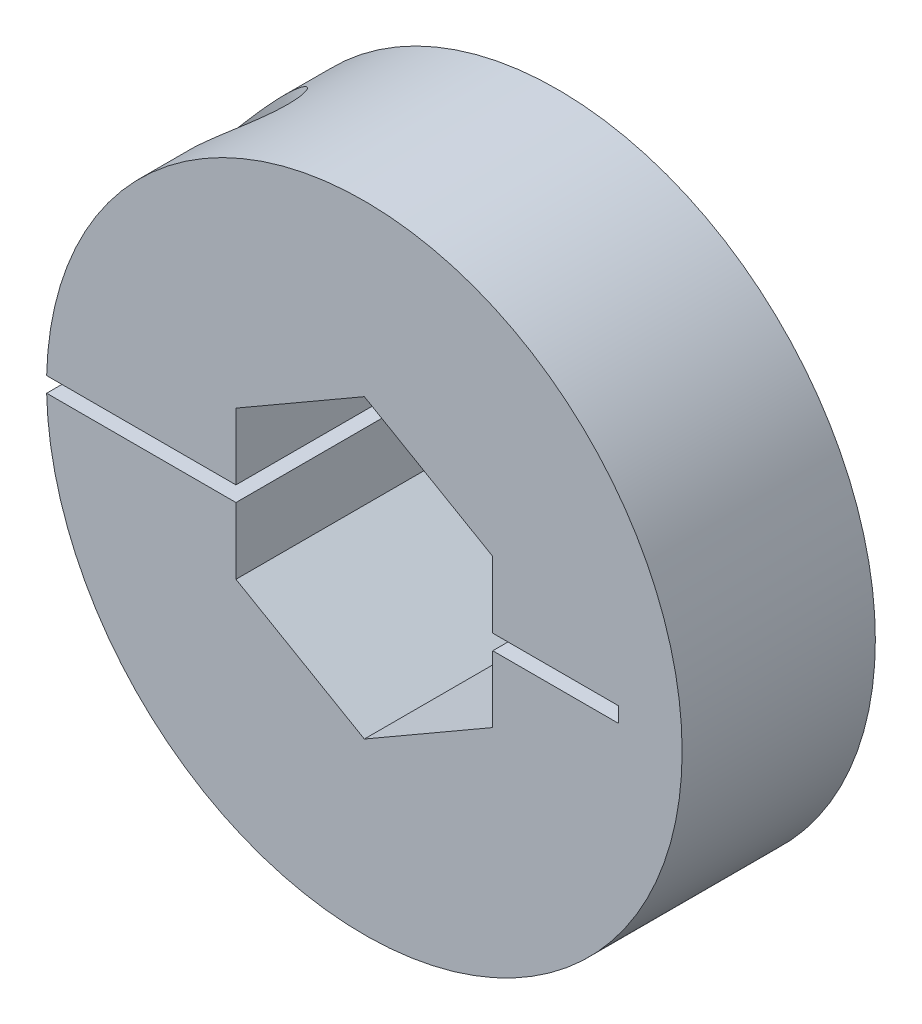
from build123d import *

# Parameters (mm, degrees)
SKETCH1_R               = 15.875
BOSS_EXTRUDE1_DEPTH     = 4.826
CUT_EXTRUDE1_DEPTH      = 25.437519391
CUT_EXTRUDE2_DEPTH      = 25.437519391
CUT_EXTRUDE3_DEPTH      = 23.963482445
CUT_EXTRUDE3_DEPTH_BACK = 23.963482445
SKETCH4_R               = 2.3876


with BuildPart() as part:
    # Sketch1 → Boss-Extrude1 (new, symmetric)
    with BuildSketch(Plane.XY):
        Circle(SKETCH1_R)
    extrude(amount=BOSS_EXTRUDE1_DEPTH, both=True)

    # Sketch2 → Cut-Extrude1 (cut, through all)
    with BuildSketch(Plane.XY.offset(4.826)):
        Polygon((-6.4135, 3.702835951), (-6.4135, -3.702835951), (0, -7.405671903), (6.4135, -3.702835951), (6.4135, 3.702835951), (0, 7.405671903), align=None)
    extrude(amount=-CUT_EXTRUDE1_DEPTH, mode=Mode.SUBTRACT)

    # Sketch3 → Cut-Extrude2 (cut, through all)
    with BuildSketch(Plane.XY.offset(4.826)):
        with BuildLine():
            Line((-15.870427341, 0.381), (12.7, 0.381))
            Line((12.7, 0.381), (12.7, -0.381))
            Line((12.7, -0.381), (-15.870427341, -0.381))
            ThreePointArc((-15.870427341, -0.381), (-15.875, 0), (-15.870427341, 0.381))
        make_face()
    extrude(amount=-CUT_EXTRUDE2_DEPTH, mode=Mode.SUBTRACT)

    # Sketch4 → Cut-Extrude3 (cut, two sides: drawn at the far end of the back side and taken through both)
    with BuildSketch(Plane(origin=(0, 0, 0), x_dir=(1, 0, 0), z_dir=(0, 1, 0)).offset(-CUT_EXTRUDE3_DEPTH_BACK)):
        with Locations(Location((-11.044427341, 0, 0), (0, 0, 270))):
            Circle(SKETCH4_R)
    extrude(amount=CUT_EXTRUDE3_DEPTH + CUT_EXTRUDE3_DEPTH_BACK, mode=Mode.SUBTRACT)


solid = part.part
